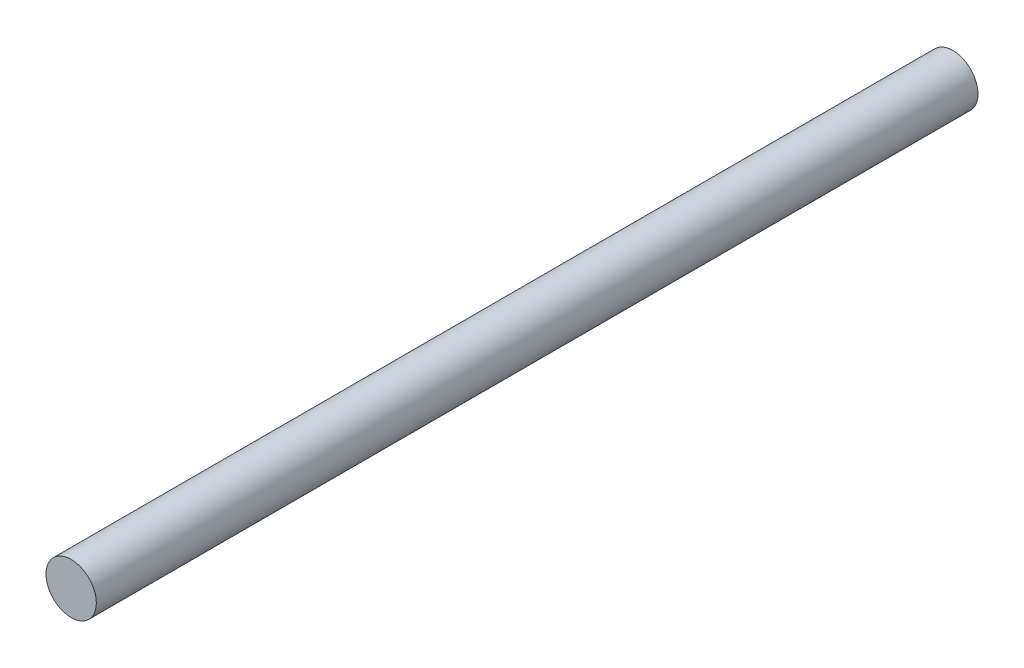
from build123d import *

# Parameters (mm, degrees)
PACK_VAKUM_HORTUMU_D8_START = -420
SKETCH1_R                   = 4
PACK_VAKUM_HORTUMU_D8_DEPTH = 140


with BuildPart() as part:
    # Sketch1 → PACK_vakum_hortumu_D8 (new body)
    with BuildSketch(Plane.XY.offset(PACK_VAKUM_HORTUMU_D8_START)):
        with Locations((500, 420)):
            Circle(SKETCH1_R)
    extrude(amount=-PACK_VAKUM_HORTUMU_D8_DEPTH)


solid = part.part
